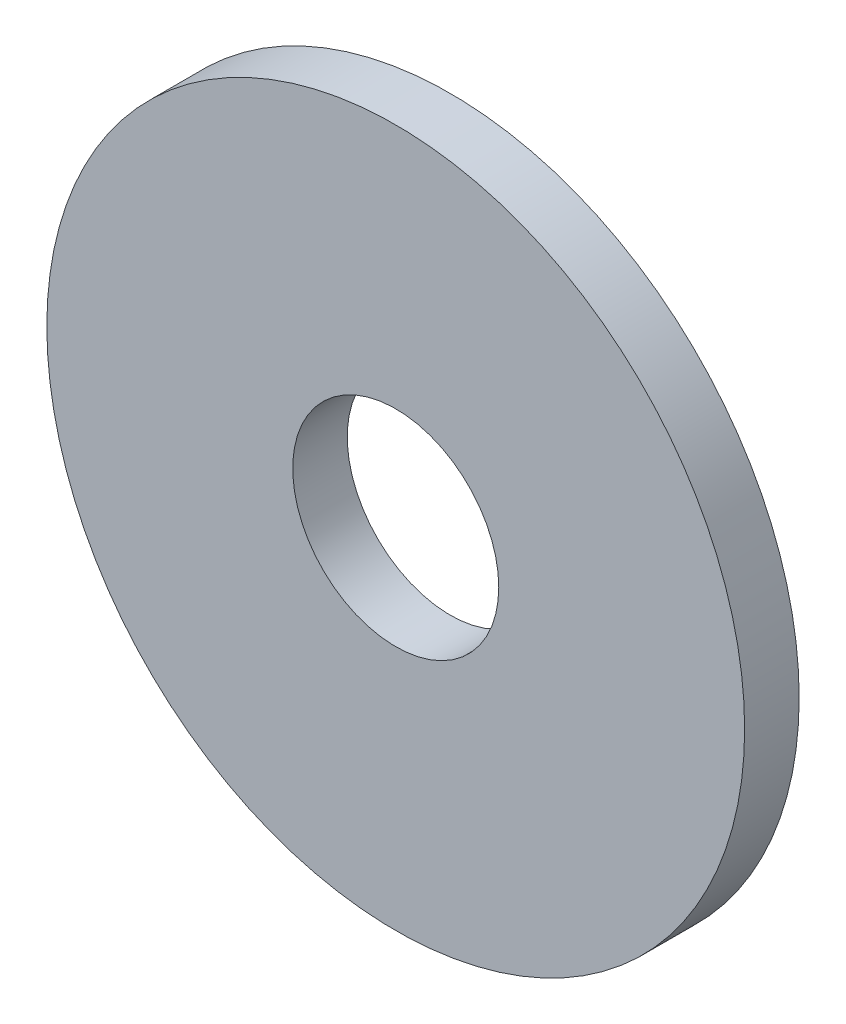
from build123d import *

# Parameters (mm, degrees)
BASEPLATE_R         = 101.6
BASEPLATE_R_2       = 30
BOSS_EXTRUDE1_DEPTH = 15.875


with BuildPart() as part:
    # Baseplate → Boss-Extrude1 (new body)
    with BuildSketch(Plane.XY):
        Circle(BASEPLATE_R)
        Circle(BASEPLATE_R_2, mode=Mode.SUBTRACT)
    extrude(amount=BOSS_EXTRUDE1_DEPTH)


solid = part.part
